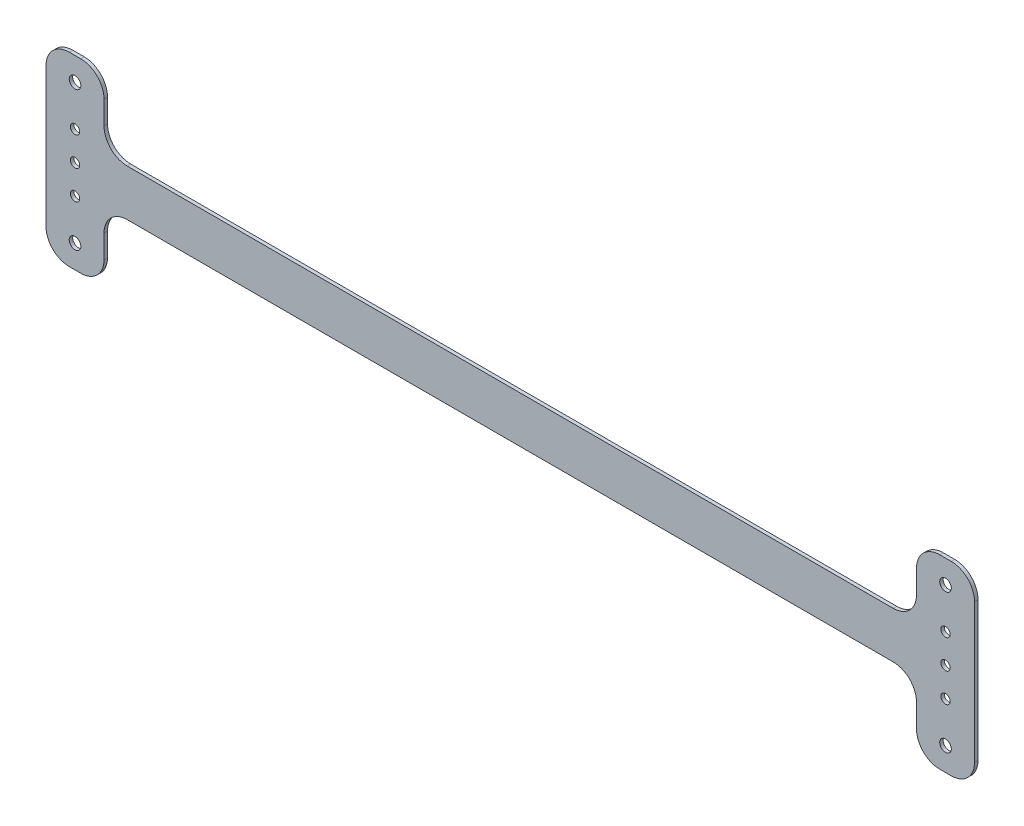
from build123d import *

# Parameters (mm, degrees)
SKETCH1_W           = 700
SKETCH1_H           = 40
SKETCH1_W_2         = 50
SKETCH1_H_2         = 160
SKETCH1_R           = 5
BOSS_EXTRUDE1_DEPTH = 3
FILLET1_R           = 20
SKETCH2_R           = 4
CUT_EXTRUDE1_DEPTH  = 757.643244865


with BuildPart() as part:
    # Sketch1 → Boss-Extrude1 (new body)
    # profile 1 of 3: a face of its own
    with BuildSketch(Plane.XY):
        with Locations((350, 20)):
            Rectangle(SKETCH1_W, SKETCH1_H)
    # profile 2 of 3: a face of its own
    with BuildSketch(Plane.XY):
        with Locations((-25, 20)):
            Rectangle(SKETCH1_W_2, SKETCH1_H_2)
        with Locations((-25, 80)):
            Circle(SKETCH1_R, mode=Mode.SUBTRACT)
        with Locations((-25, -40)):
            Circle(SKETCH1_R, mode=Mode.SUBTRACT)
    # profile 3 of 3: a face of its own
    with BuildSketch(Plane.XY):
        with Locations((725, 20)):
            Rectangle(SKETCH1_W_2, SKETCH1_H_2)
        with Locations((725, 80)):
            Circle(SKETCH1_R, mode=Mode.SUBTRACT)
        with Locations((725, -40)):
            Circle(SKETCH1_R, mode=Mode.SUBTRACT)
    extrude(amount=BOSS_EXTRUDE1_DEPTH)

    # Fillet1
    fillet1_edges = [part.edges().sort_by_distance(p)[0] for p in [
        (0, 0, 1.5),
        (0, -60, 1.5),
        (-50, -60, 1.5),
        (-50, 100, 1.5),
        (0, 100, 1.5),
        (0, 40, 1.5),
        (700, 40, 1.5),
        (700, 100, 1.5),
        (750, 100, 1.5),
        (750, -60, 1.5),
        (700, -60, 1.5),
        (700, 0, 1.5),
    ]]
    fillet(fillet1_edges, radius=FILLET1_R)

    # Sketch2 → Cut-Extrude1 (cut, through all)
    with BuildSketch(Plane.XY.offset(3)):
        with Locations((-25, 45)):
            Circle(SKETCH2_R)
        with Locations((-25, -5)):
            Circle(SKETCH2_R)
        with Locations((-25, 20)):
            Circle(SKETCH2_R)
        with Locations(Location((725, 20, 0), (0, 0, 180))):
            Circle(SKETCH2_R)
        with Locations(Location((725, -5, 0), (0, 0, 180))):
            Circle(SKETCH2_R)
        with Locations(Location((725, 45, 0), (0, 0, 180))):
            Circle(SKETCH2_R)
    extrude(amount=-CUT_EXTRUDE1_DEPTH, mode=Mode.SUBTRACT)


solid = part.part
